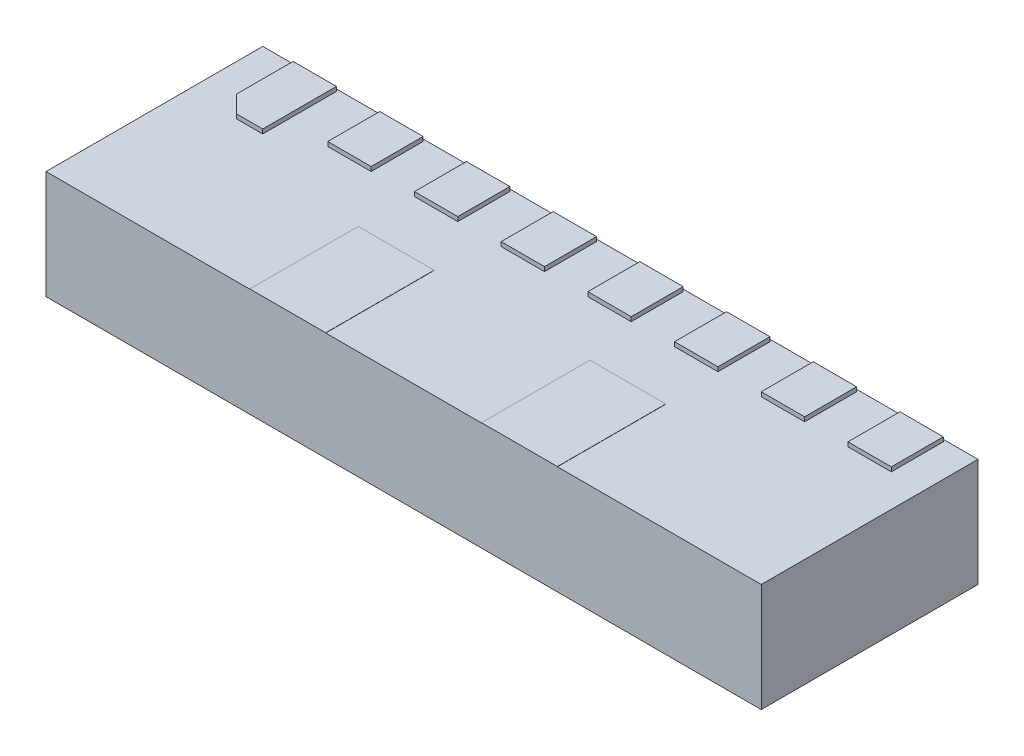
from build123d import *

# Parameters (mm, degrees)
SKETCH1_W           = 3.3
SKETCH1_H           = 1
BOSS_EXTRUDE1_DEPTH = 0.5
SKETCH2_W           = 0.35
SKETCH2_H           = 0.5
BOSS_EXTRUDE2_DEPTH = 0.001
SKETCH3_W           = 0.2
SKETCH3_H           = 0.24
BOSS_EXTRUDE3_DEPTH = 0.02
BOSS_EXTRUDE4_DEPTH = 0.02
SKETCH11_W          = 0.2
SKETCH11_H          = 0.105
BOSS_EXTRUDE5_DEPTH = 0.001


with BuildPart() as part:
    # Sketch1 → Boss-Extrude1 (new body)
    with BuildSketch(Plane(origin=(0, 0, 0), x_dir=(1, 0, 0), z_dir=(0, 1, 0))):
        Rectangle(SKETCH1_W, SKETCH1_H)
    extrude(amount=BOSS_EXTRUDE1_DEPTH)

    # Sketch2 → Boss-Extrude2 (add)
    with BuildSketch(Plane(origin=(0, 0.5, 0), x_dir=(1, 0, 0), z_dir=(0, 1, 0))):
        with Locations((0.534443551, -0.25)):
            Rectangle(SKETCH2_W, SKETCH2_H)
        with Locations((-0.534443551, -0.25)):
            Rectangle(SKETCH2_W, SKETCH2_H)
    extrude(amount=BOSS_EXTRUDE2_DEPTH)

    # Sketch3 → Boss-Extrude3 (add)
    with BuildSketch(Plane(origin=(0, 0.5, 0), x_dir=(1, 0, 0), z_dir=(0, 1, 0))):
        with Locations((0.6, 0.37)):
            Rectangle(SKETCH3_W, SKETCH3_H)
        with Locations((0.2, 0.37)):
            Rectangle(SKETCH3_W, SKETCH3_H)
        with Locations((1, 0.37)):
            Rectangle(SKETCH3_W, SKETCH3_H)
        with Locations((1.4, 0.37)):
            Rectangle(SKETCH3_W, SKETCH3_H)
        with Locations((-0.2, 0.37)):
            Rectangle(SKETCH3_W, SKETCH3_H)
        with Locations((-0.6, 0.37)):
            Rectangle(SKETCH3_W, SKETCH3_H)
        with Locations((-1, 0.37)):
            Rectangle(SKETCH3_W, SKETCH3_H)
    extrude(amount=BOSS_EXTRUDE3_DEPTH)

    # Sketch6 → Boss-Extrude4 (add)
    with BuildSketch(Plane(origin=(0, 0.5, 0), x_dir=(1, 0, 0), z_dir=(0, 1, 0))):
        Polygon((-1.5, 0.49), (-1.3, 0.49), (-1.3, 0.15), (-1.420266978, 0.15), (-1.5, 0.229733022), align=None)
    extrude(amount=BOSS_EXTRUDE4_DEPTH)

    # Sketch11 → Boss-Extrude5 (add)
    with BuildSketch(Plane(origin=(0, 0, -0.5), x_dir=(-1, 0, 0), z_dir=(0, 0, -1))):
        with Locations((0.2, 0.4425)):
            Rectangle(SKETCH11_W, SKETCH11_H)
        with Locations((-0.2, 0.4425)):
            Rectangle(SKETCH11_W, SKETCH11_H)
        with Locations((0.6, 0.4425)):
            Rectangle(SKETCH11_W, SKETCH11_H)
        with Locations((1, 0.4425)):
            Rectangle(SKETCH11_W, SKETCH11_H)
        with Locations((1.4, 0.4425)):
            Rectangle(SKETCH11_W, SKETCH11_H)
        with Locations((-0.6, 0.4425)):
            Rectangle(SKETCH11_W, SKETCH11_H)
        with Locations((-1, 0.4425)):
            Rectangle(SKETCH11_W, SKETCH11_H)
        with Locations((-1.4, 0.4425)):
            Rectangle(SKETCH11_W, SKETCH11_H)
    extrude(amount=BOSS_EXTRUDE5_DEPTH)


solid = part.part
